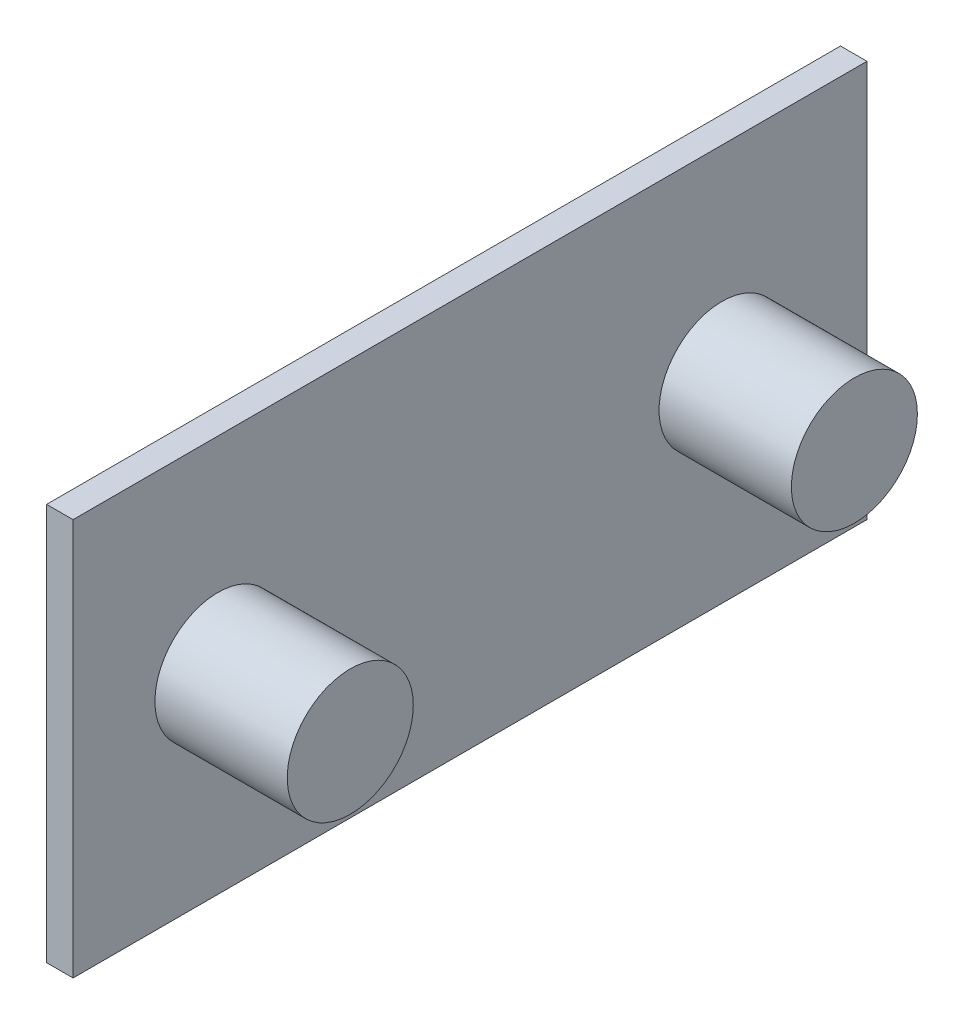
from build123d import *

# Parameters (mm, degrees)
SKETCH2_W           = 60
SKETCH2_H           = 30
SKETCH2_R           = 4.7625
BOSS_EXTRUDE1_DEPTH = 2
BOSS_EXTRUDE2_START = 2
SKETCH2_3_R         = 4.7625
BOSS_EXTRUDE2_DEPTH = 10


with BuildPart() as part:
    # Sketch2 → Boss-Extrude1 (new body)
    # profile 1 of 3: a face of its own
    with BuildSketch(Plane(origin=(0, 0, 0), x_dir=(0, 0, -1), z_dir=(1, 0, 0))):
        Rectangle(SKETCH2_W, SKETCH2_H)
        with Locations((19.05, 0)):
            Circle(SKETCH2_R, mode=Mode.SUBTRACT)
        with Locations((-19.05, 0)):
            Circle(SKETCH2_R, mode=Mode.SUBTRACT)
    # profile 2 of 3: a face of its own
    with BuildSketch(Plane(origin=(0, 0, 0), x_dir=(0, 0, -1), z_dir=(1, 0, 0))):
        with Locations((19.05, 0)):
            Circle(SKETCH2_R)
    # profile 3 of 3: a face of its own
    with BuildSketch(Plane(origin=(0, 0, 0), x_dir=(0, 0, -1), z_dir=(1, 0, 0))):
        with Locations((-19.05, 0)):
            Circle(SKETCH2_R)
    extrude(amount=BOSS_EXTRUDE1_DEPTH)

    # Sketch2<3> → Boss-Extrude2 (add)
    with BuildSketch(Plane(origin=(0, 0, 0), x_dir=(0, 0, -1), z_dir=(1, 0, 0)).offset(BOSS_EXTRUDE2_START)):
        with Locations((-19.05, 0)):
            Circle(SKETCH2_3_R)
        with Locations((19.05, 0)):
            Circle(SKETCH2_3_R)
    extrude(amount=BOSS_EXTRUDE2_DEPTH)


solid = part.part
